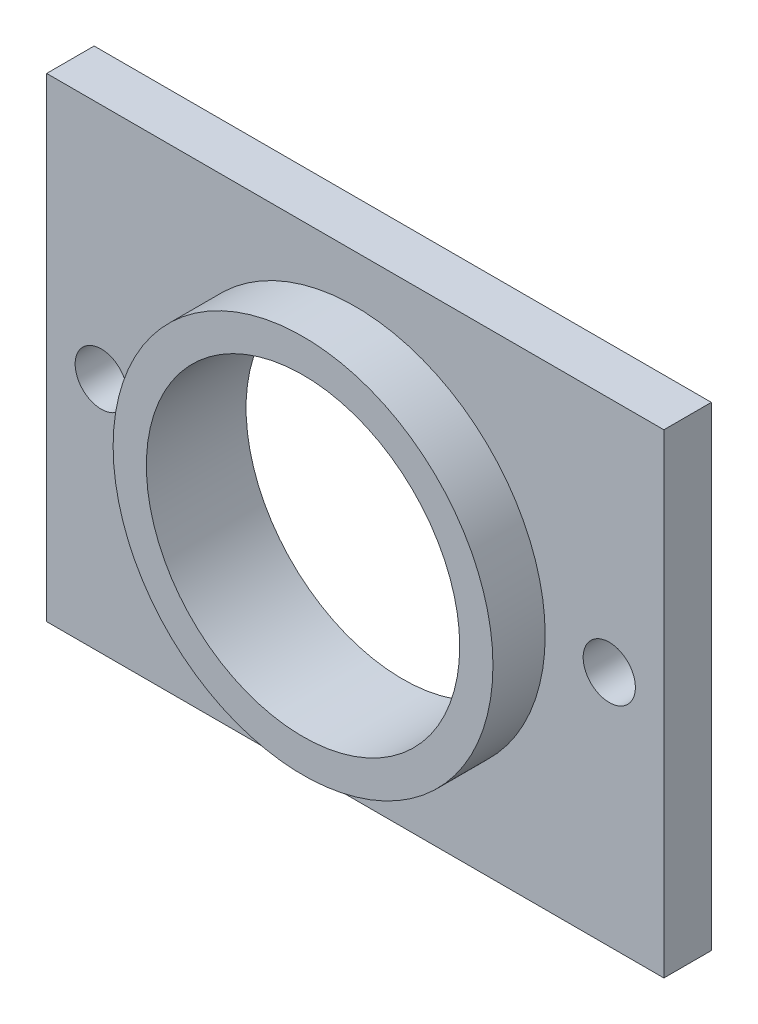
from build123d import *

# Parameters (mm, degrees)
CAP_PLATE_26X20X2_START           = -12.4
CAP_PLATE_26X20X2_PROFILE_W       = 26
CAP_PLATE_26X20X2_PROFILE_H       = 20
CAP_PLATE_26X20X2_PROFILE_R       = 6.6
CAP_PLATE_26X20X2_PROFILE_R_2     = 1.1
CAP_PLATE_26X20X2_DEPTH           = 2
BEARING_RETENTION_LIP_START       = -10.41
BEARING_RETENTION_LIP_PROFILE_R   = 8
BEARING_RETENTION_LIP_PROFILE_R_2 = 6.6
BEARING_RETENTION_LIP_DEPTH       = 2.21


with BuildPart() as part:
    # Cap_plate_26x20x2_Profile → Cap_plate_26x20x2 (new body)
    with BuildSketch(Plane.XY.offset(CAP_PLATE_26X20X2_START)):
        with Locations((12.5, 0)):
            Rectangle(CAP_PLATE_26X20X2_PROFILE_W, CAP_PLATE_26X20X2_PROFILE_H)
        with Locations((12.5, 0)):
            Circle(CAP_PLATE_26X20X2_PROFILE_R, mode=Mode.SUBTRACT)
        with Locations((1.8, 0)):
            Circle(CAP_PLATE_26X20X2_PROFILE_R_2, mode=Mode.SUBTRACT)
        with Locations((23.2, 0)):
            Circle(CAP_PLATE_26X20X2_PROFILE_R_2, mode=Mode.SUBTRACT)
    extrude(amount=CAP_PLATE_26X20X2_DEPTH)

    # Bearing_retention_lip_Profile → Bearing_retention_lip (add)
    with BuildSketch(Plane.XY.offset(BEARING_RETENTION_LIP_START)):
        with Locations(Location((12.5, 0, 0), (0, 0, 180))):
            Circle(BEARING_RETENTION_LIP_PROFILE_R)
        with Locations((12.5, 0)):
            Circle(BEARING_RETENTION_LIP_PROFILE_R_2, mode=Mode.SUBTRACT)
    extrude(amount=BEARING_RETENTION_LIP_DEPTH)


solid = part.part
